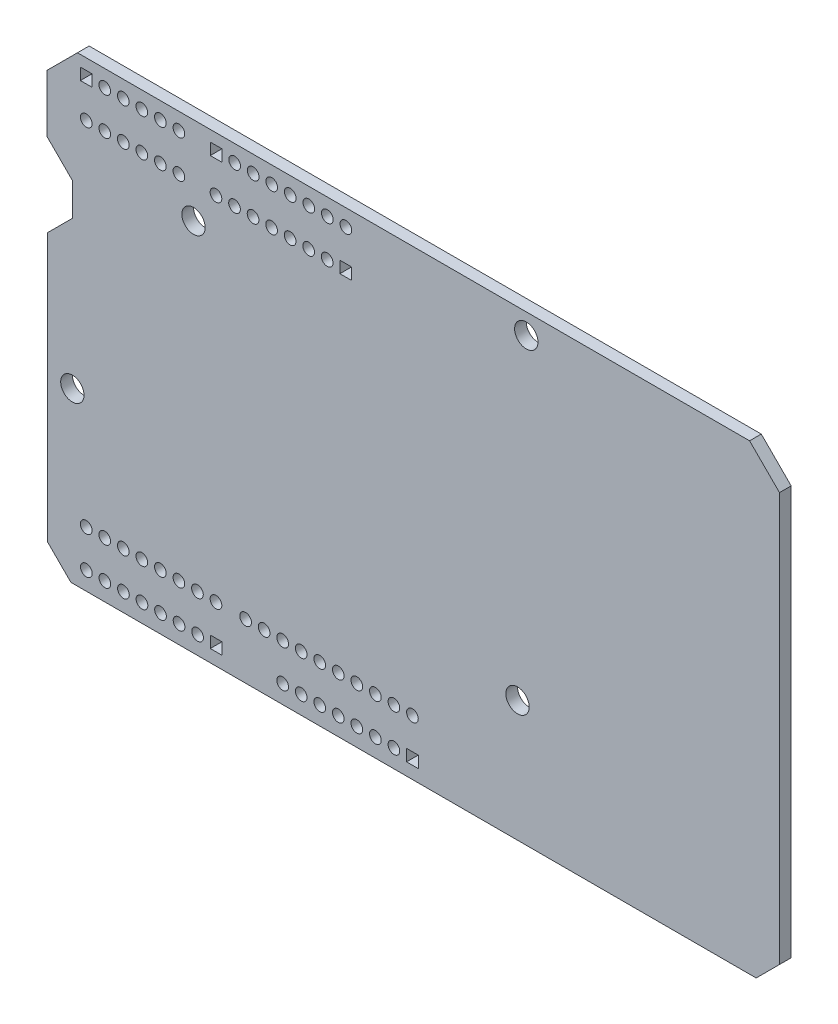
from build123d import *

# Parameters (mm, degrees)
MODEL_R            = 0.8
MODEL_R_2          = 1.59995
MODEL_W            = 1.6
MODEL_H            = 1.6
BOSS_EXTRU_1_DEPTH = 1.6


with BuildPart() as part:
    # Model → Boss.-Extru.1 (new body)
    with BuildSketch(Plane.XY):
        Polygon((0, 3.2), (0, 39.9), (3.4, 43.3), (3.4, 47.8), (-0.1, 51.3), (-0.1, 59.1), (4.1, 63.3), (96.2, 63.3), (100.3, 59.2), (100.3, 3.2), (97.1, 0), (3.2, 0), align=None)
        with Locations((5.3, 7.6)):
            Circle(MODEL_R, mode=Mode.SUBTRACT)
        with Locations((7.84, 7.6)):
            Circle(MODEL_R, mode=Mode.SUBTRACT)
        with Locations((10.38, 7.6)):
            Circle(MODEL_R, mode=Mode.SUBTRACT)
        with Locations((12.92, 7.6)):
            Circle(MODEL_R, mode=Mode.SUBTRACT)
        with Locations((15.46, 7.6)):
            Circle(MODEL_R, mode=Mode.SUBTRACT)
        with Locations((18, 7.6)):
            Circle(MODEL_R, mode=Mode.SUBTRACT)
        with Locations((20.54, 7.6)):
            Circle(MODEL_R, mode=Mode.SUBTRACT)
        with Locations((23.08, 7.6)):
            Circle(MODEL_R, mode=Mode.SUBTRACT)
        with Locations((27.14, 7.6)):
            Circle(MODEL_R, mode=Mode.SUBTRACT)
        with Locations((29.68, 7.6)):
            Circle(MODEL_R, mode=Mode.SUBTRACT)
        with Locations((32.22, 7.6)):
            Circle(MODEL_R, mode=Mode.SUBTRACT)
        with Locations((34.76, 7.6)):
            Circle(MODEL_R, mode=Mode.SUBTRACT)
        with Locations((37.3, 7.6)):
            Circle(MODEL_R, mode=Mode.SUBTRACT)
        with Locations((39.84, 7.6)):
            Circle(MODEL_R, mode=Mode.SUBTRACT)
        with Locations((42.38, 7.6)):
            Circle(MODEL_R, mode=Mode.SUBTRACT)
        with Locations((44.92, 7.6)):
            Circle(MODEL_R, mode=Mode.SUBTRACT)
        with Locations((47.46, 7.6)):
            Circle(MODEL_R, mode=Mode.SUBTRACT)
        with Locations((50, 7.6)):
            Circle(MODEL_R, mode=Mode.SUBTRACT)
        with Locations((38.32, 55.86)):
            Circle(MODEL_R, mode=Mode.SUBTRACT)
        with Locations((35.78, 55.86)):
            Circle(MODEL_R, mode=Mode.SUBTRACT)
        with Locations((33.24, 55.86)):
            Circle(MODEL_R, mode=Mode.SUBTRACT)
        with Locations((30.7, 55.86)):
            Circle(MODEL_R, mode=Mode.SUBTRACT)
        with Locations((28.16, 55.86)):
            Circle(MODEL_R, mode=Mode.SUBTRACT)
        with Locations((25.62, 55.86)):
            Circle(MODEL_R, mode=Mode.SUBTRACT)
        with Locations((23.08, 55.86)):
            Circle(MODEL_R, mode=Mode.SUBTRACT)
        with Locations((18, 55.86)):
            Circle(MODEL_R, mode=Mode.SUBTRACT)
        with Locations((15.46, 55.86)):
            Circle(MODEL_R, mode=Mode.SUBTRACT)
        with Locations((12.92, 55.86)):
            Circle(MODEL_R, mode=Mode.SUBTRACT)
        with Locations((10.38, 55.86)):
            Circle(MODEL_R, mode=Mode.SUBTRACT)
        with Locations((7.84, 55.86)):
            Circle(MODEL_R, mode=Mode.SUBTRACT)
        with Locations((5.3, 55.86)):
            Circle(MODEL_R, mode=Mode.SUBTRACT)
        with Locations((20, 51.3)):
            Circle(MODEL_R_2, mode=Mode.SUBTRACT)
        with Locations((65.6, 60.5)):
            Circle(MODEL_R_2, mode=Mode.SUBTRACT)
        with Locations((64.4, 16.6)):
            Circle(MODEL_R_2, mode=Mode.SUBTRACT)
        with Locations((3.4, 23.1)):
            Circle(MODEL_R_2, mode=Mode.SUBTRACT)
        with Locations((7.84, 61)):
            Circle(MODEL_R, mode=Mode.SUBTRACT)
        with Locations((10.38, 61)):
            Circle(MODEL_R, mode=Mode.SUBTRACT)
        with Locations((12.92, 61)):
            Circle(MODEL_R, mode=Mode.SUBTRACT)
        with Locations((15.46, 61)):
            Circle(MODEL_R, mode=Mode.SUBTRACT)
        with Locations((18, 61)):
            Circle(MODEL_R, mode=Mode.SUBTRACT)
        with Locations((47.46, 2.5)):
            Circle(MODEL_R, mode=Mode.SUBTRACT)
        with Locations((44.92, 2.5)):
            Circle(MODEL_R, mode=Mode.SUBTRACT)
        with Locations((42.38, 2.5)):
            Circle(MODEL_R, mode=Mode.SUBTRACT)
        with Locations((39.84, 2.5)):
            Circle(MODEL_R, mode=Mode.SUBTRACT)
        with Locations((37.3, 2.5)):
            Circle(MODEL_R, mode=Mode.SUBTRACT)
        with Locations((34.76, 2.5)):
            Circle(MODEL_R, mode=Mode.SUBTRACT)
        with Locations((32.22, 2.5)):
            Circle(MODEL_R, mode=Mode.SUBTRACT)
        with Locations((20.56, 2.5)):
            Circle(MODEL_R, mode=Mode.SUBTRACT)
        with Locations((18.02, 2.5)):
            Circle(MODEL_R, mode=Mode.SUBTRACT)
        with Locations((15.48, 2.5)):
            Circle(MODEL_R, mode=Mode.SUBTRACT)
        with Locations((12.94, 2.5)):
            Circle(MODEL_R, mode=Mode.SUBTRACT)
        with Locations((10.4, 2.5)):
            Circle(MODEL_R, mode=Mode.SUBTRACT)
        with Locations((7.86, 2.5)):
            Circle(MODEL_R, mode=Mode.SUBTRACT)
        with Locations((5.32, 2.5)):
            Circle(MODEL_R, mode=Mode.SUBTRACT)
        with Locations((25.64, 61)):
            Circle(MODEL_R, mode=Mode.SUBTRACT)
        with Locations((28.18, 61)):
            Circle(MODEL_R, mode=Mode.SUBTRACT)
        with Locations((30.72, 61)):
            Circle(MODEL_R, mode=Mode.SUBTRACT)
        with Locations((33.26, 61)):
            Circle(MODEL_R, mode=Mode.SUBTRACT)
        with Locations((35.8, 61)):
            Circle(MODEL_R, mode=Mode.SUBTRACT)
        with Locations((38.34, 61)):
            Circle(MODEL_R, mode=Mode.SUBTRACT)
        with Locations((40.88, 61)):
            Circle(MODEL_R, mode=Mode.SUBTRACT)
        with Locations((40.86, 55.86)):
            Rectangle(MODEL_W, MODEL_H, mode=Mode.SUBTRACT)
        with Locations((5.3, 61)):
            Rectangle(MODEL_W, MODEL_H, mode=Mode.SUBTRACT)
        with Locations((50, 2.5)):
            Rectangle(MODEL_W, MODEL_H, mode=Mode.SUBTRACT)
        with Locations((23.1, 2.5)):
            Rectangle(MODEL_W, MODEL_H, mode=Mode.SUBTRACT)
        with Locations((23.1, 61)):
            Rectangle(MODEL_W, MODEL_H, mode=Mode.SUBTRACT)
    extrude(amount=BOSS_EXTRU_1_DEPTH)


solid = part.part
